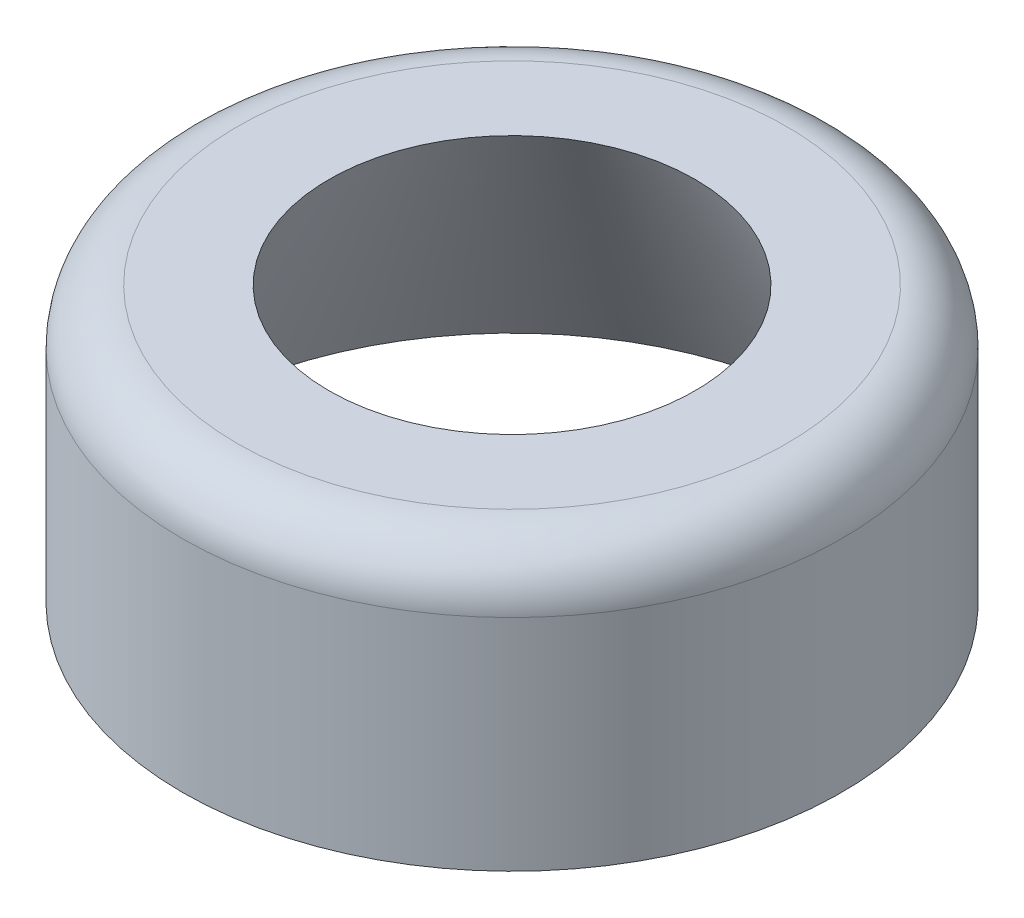
from build123d import *


with BuildPart() as part:
    # Sketch1 → Revolve-Thin1 (revolve)
    with BuildSketch(Plane.XY, mode=Mode.PRIVATE) as revolve_thin1_sk:
        with BuildLine():
            Line((12.954, -1.905), (12.954, -10.541))
            Line((12.954, -10.541), (7.196666667, 0.254))
            Line((7.196666667, 0.254), (10.795, 0.254))
            ThreePointArc((10.795, 0.254), (12.321643541, -0.378356459), (12.954, -1.905))
        make_face()
        with BuildLine():
            Line((12.446, -1.905), (12.446, -8.509))
            Line((12.446, -8.509), (8.043333333, -0.254))
            Line((8.043333333, -0.254), (10.795, -0.254))
            ThreePointArc((10.795, -0.254), (11.962433296, -0.737566704), (12.446, -1.905))
        make_face(mode=Mode.SUBTRACT)
    revolve(revolve_thin1_sk.sketch.rotate(Axis((0, 31.836101695, 0), (0, -1, 0)), 90), axis=Axis((0, 31.836101695, 0), (0, -1, 0)))


solid = part.part
